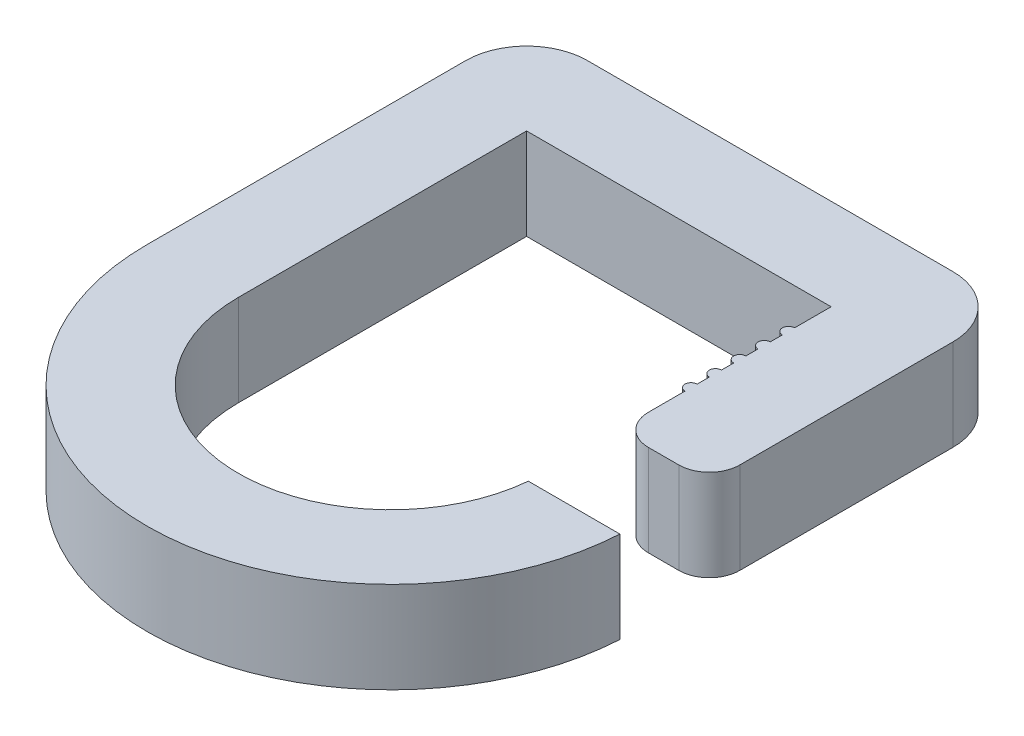
from build123d import *

# Parameters (mm, degrees)
BOSS_EXTRUDE1_DEPTH = 15
FILLET2_R           = 10
FILLET3_R           = 5
SKETCH3_R           = 1
BOSS_EXTRUDE2_DEPTH = 15


with BuildPart() as part:
    # Sketch2 → Boss-Extrude1 (new body)
    with BuildSketch(Plane(origin=(0, 0, 0), x_dir=(1, 0, 0), z_dir=(0, 1, 0))):
        with BuildLine():
            Line((64.937954364, -49.659577053), (79.978719708, -49.659577053))
            ThreePointArc((79.978719708, -49.659577053), (38.858723791, -87.337822877), (0, -47.331525149))
            Line((0, -47.331525149), (0, 0))
            Line((0, 0), (0, 15))
            Line((0, 15), (80, 15))
            Line((80, 15), (80, 0))
            Line((80, 0), (80, -35))
            Line((80, -35), (65, -35))
            Line((65, -35), (65, 0))
            Line((65, 0), (15, 0))
            Line((15, 0), (15, -47.331525149))
            ThreePointArc((15, -47.331525149), (38.857952611, -72.327620402), (64.937954364, -49.659577053))
        make_face()
    extrude(amount=BOSS_EXTRUDE1_DEPTH)

    # Fillet2
    fillet2_edges = [part.edges().sort_by_distance(p)[0] for p in [
        (0, 7.5, -15),
        (80, 7.5, -15),
    ]]
    fillet(fillet2_edges, radius=FILLET2_R)

    # Fillet3
    fillet3_edges = [part.edges().sort_by_distance(p)[0] for p in [
        (80, 7.5, 35),
        (65, 7.5, 35),
    ]]
    fillet(fillet3_edges, radius=FILLET3_R)

    # Sketch3 → Boss-Extrude2 (add)
    with BuildSketch(Plane(origin=(0, 15, 0), x_dir=(1, 0, 0), z_dir=(0, 1, 0))):
        with Locations((65, -15)):
            Circle(SKETCH3_R)
        with Locations((65, -11)):
            Circle(SKETCH3_R)
        with Locations((65, -23)):
            Circle(SKETCH3_R)
        with Locations((65, -19)):
            Circle(SKETCH3_R)
        with Locations((65, -7)):
            Circle(SKETCH3_R)
    extrude(amount=-BOSS_EXTRUDE2_DEPTH)


solid = part.part
